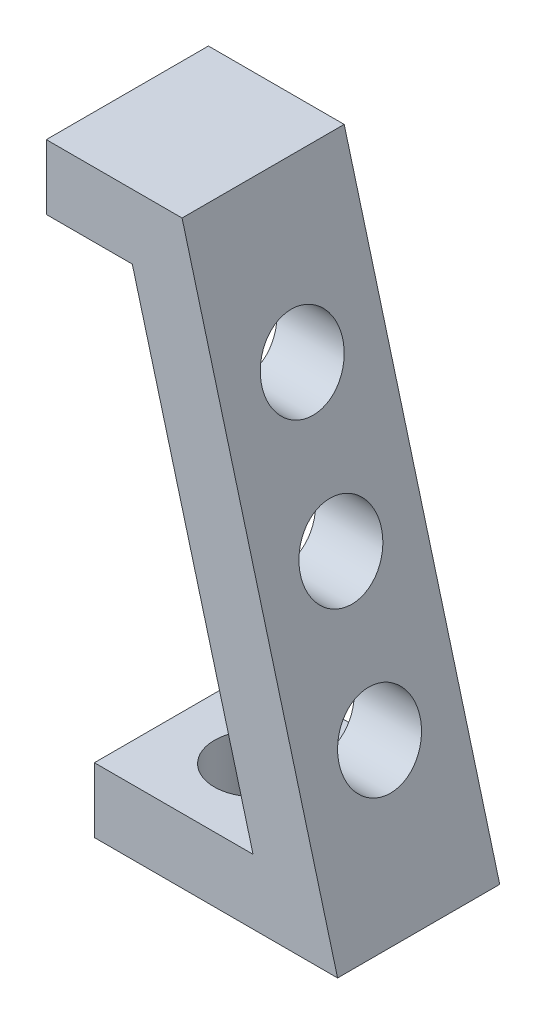
from build123d import *

# Parameters (mm, degrees)
BOSS_EXTRUDE1_DEPTH     = 10
CUT_EXTRUDE1_DEPTH      = 10
CUT_EXTRUDE1_DEPTH_BACK = 15
SKETCH2_R               = 2.5
SKETCH3_R               = 2.5
CUT_EXTRUDE2_DEPTH      = 15


with BuildPart() as part:
    # Sketch1 → Boss-Extrude1 (new body)
    with BuildSketch(Plane.XY):
        Polygon((-6.068965517, -4), (8.931034483, -4), (-0.661546606, 31.8), (-9.036163723, 31.8), (-9.036163723, 27.802335145), (-3.731480258, 27.802335145), (3.718132991, 0), (-6.068965517, 0), align=None)
    extrude(amount=BOSS_EXTRUDE1_DEPTH)

    # Sketch2 → Cut-Extrude1 (cut, two sides: drawn at the far end of the back side and taken through both)
    with BuildSketch(Plane.ZY.offset(6.068965517).offset(-CUT_EXTRUDE1_DEPTH_BACK)):
        with Locations(Location((5, 22.802335145, 0), (0, 0, 270))):
            Circle(SKETCH2_R)
        with Locations(Location((5, 5, 0), (0, 0, 270))):
            Circle(SKETCH2_R)
        with Locations(Location((5, 13.9, 0), (0, 0, 270))):
            Circle(SKETCH2_R)
    extrude(amount=CUT_EXTRUDE1_DEPTH + CUT_EXTRUDE1_DEPTH_BACK, mode=Mode.SUBTRACT)

    # Sketch3 → Cut-Extrude2 (cut)
    with BuildSketch(Plane(origin=(0, 0, 0), x_dir=(1, 0, 0), z_dir=(0, 1, 0))):
        with Locations(Location((-1.068965517, -5.100482612, 0), (0, 0, 180))):
            Circle(SKETCH3_R)
    extrude(amount=-CUT_EXTRUDE2_DEPTH, mode=Mode.SUBTRACT)


solid = part.part
